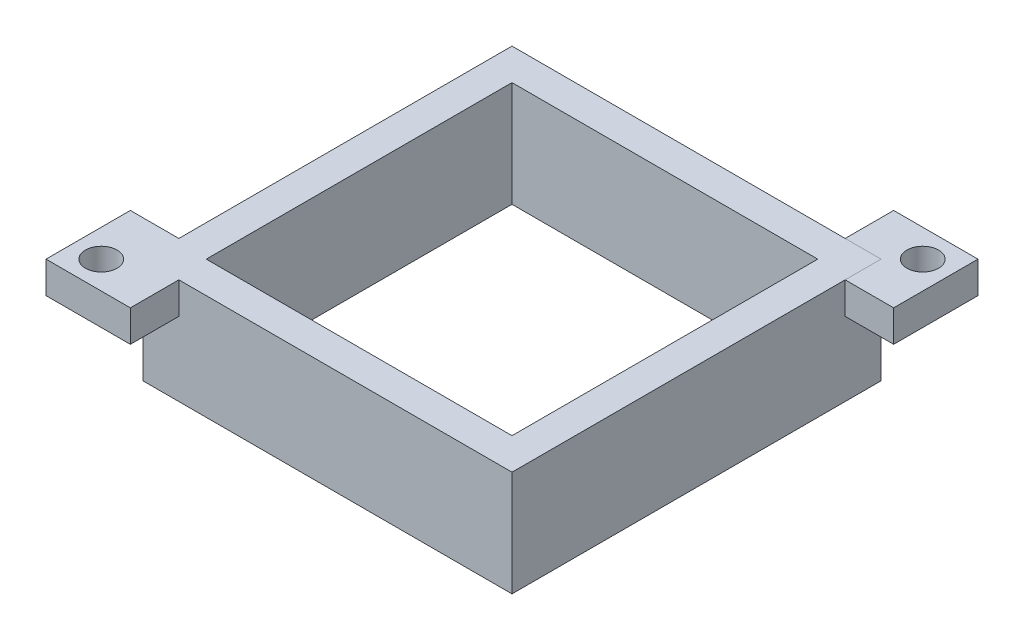
from build123d import *

# Parameters (mm, degrees)
SKETCH1_W           = 35
SKETCH1_H           = 35
SKETCH1_W_2         = 29
SKETCH1_H_2         = 29
BOSS_EXTRUDE1_DEPTH = 10
SKETCH2_R           = 1.5
BOSS_EXTRUDE2_DEPTH = 3


with BuildPart() as part:
    # Sketch1 → Boss-Extrude1 (new body)
    with BuildSketch(Plane(origin=(0, 0, 0), x_dir=(1, 0, 0), z_dir=(0, 1, 0))):
        Rectangle(SKETCH1_W, SKETCH1_H)
        Rectangle(SKETCH1_W_2, SKETCH1_H_2, mode=Mode.SUBTRACT)
    extrude(amount=BOSS_EXTRUDE1_DEPTH)


with BuildPart() as body_2:
    # Sketch2 → Boss-Extrude2 (new body)
    with BuildSketch(Plane(origin=(0, 10, 0), x_dir=(1, 0, 0), z_dir=(0, 1, 0))):
        Polygon((14.1, 17.5), (14.1, 22.1), (22.1, 22.1), (22.1, 14.1), (17.5, 14.1), (17.5, 17.5), align=None)
        with Locations(Location((19.479898987, 19.479898987, 0), (0, 0, 270))):
            Circle(SKETCH2_R, mode=Mode.SUBTRACT)
    boss_extrude2 = extrude(amount=-BOSS_EXTRUDE2_DEPTH)


with BuildPart() as part_1:
    add(part.part)

    # Mirror3: Boss-Extrude2 across plane
    add(boss_extrude2.mirror(Plane(origin=(0, 0, 0), x_dir=(0.7071067811865476, 0, 0.7071067811865475), z_dir=(0.7071067811865475, 0, -0.7071067811865476))))


solid = Compound([body_2.part, part_1.part])
